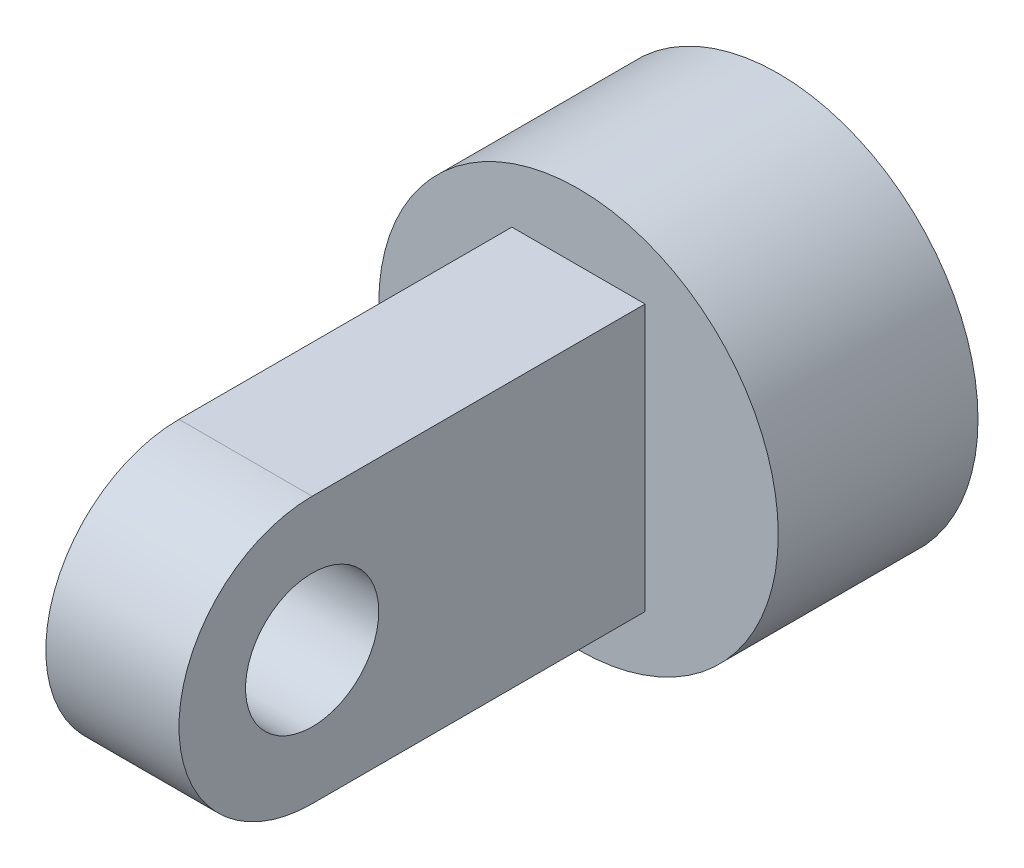
from build123d import *

# Parameters (mm, degrees)
SKETCH1_R           = 12.7
SKETCH1_R_2         = 6.35
EXTRUDE_THIN1_DEPTH = 12.7
BOSS_EXTRUDE1_START = -12.7
BOSS_EXTRUDE1_DEPTH = 12.7
SKETCH3_R           = 19.05
BOSS_EXTRUDE2_DEPTH = 19.05
SKETCH4_R           = 12.7
CUT_EXTRUDE1_DEPTH  = 6.35


with BuildPart() as part:
    # Sketch1 → Extrude-Thin1 (new body)
    with BuildSketch(Plane(origin=(0, 0, 0), x_dir=(0, 0, -1), z_dir=(1, 0, 0))):
        Circle(SKETCH1_R)
        Circle(SKETCH1_R_2, mode=Mode.SUBTRACT)
    extrude(amount=EXTRUDE_THIN1_DEPTH)

    # Sketch2 → Boss-Extrude1 (add)
    with BuildSketch(Plane(origin=(12.7, 0, 0), x_dir=(0, 0, -1), z_dir=(1, 0, 0)).offset(BOSS_EXTRUDE1_START)):
        with BuildLine():
            Line((0, 12.7), (31.75, 12.7))
            Line((31.75, 12.7), (31.75, -12.7))
            Line((31.75, -12.7), (0, -12.7))
            ThreePointArc((0, -12.7), (12.7, 0), (0, 12.7))
        make_face()
    extrude(amount=BOSS_EXTRUDE1_DEPTH)

    # Sketch3 → Boss-Extrude2 (add)
    with BuildSketch(Plane(origin=(0, 0, -31.75), x_dir=(-1, 0, 0), z_dir=(0, 0, -1))):
        with Locations(Location((-6.35, 0, 0), (0, 0, 180))):
            Circle(SKETCH3_R)
    extrude(amount=BOSS_EXTRUDE2_DEPTH)

    # Sketch4 → Cut-Extrude1 (cut)
    with BuildSketch(Plane(origin=(0, 0, -50.8), x_dir=(-1, 0, 0), z_dir=(0, 0, -1))):
        with Locations((-6.35, 0)):
            Circle(SKETCH4_R)
    extrude(amount=-CUT_EXTRUDE1_DEPTH, mode=Mode.SUBTRACT)


solid = part.part
